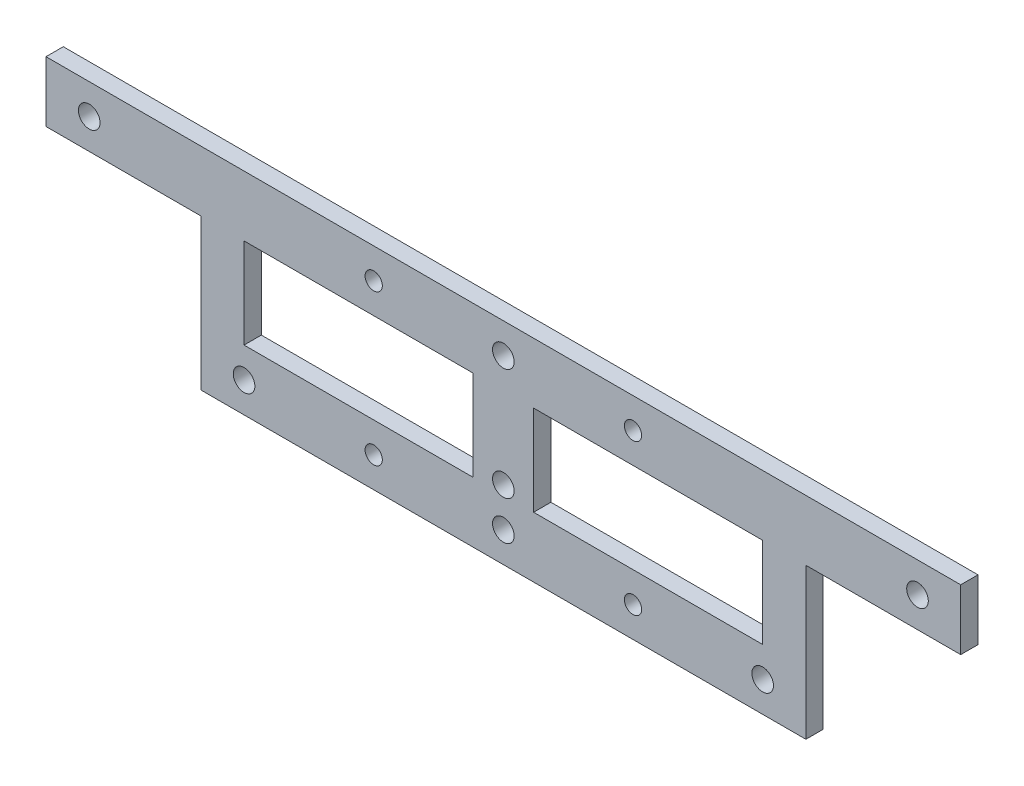
from build123d import *

# Parameters (mm, degrees)
SKETCH1_W           = 53
SKETCH1_H           = 20.877946607
SKETCH1_R           = 2.5
SKETCH1_R_2         = 2
BOSS_EXTRUDE1_DEPTH = 4


with BuildPart() as part:
    # Sketch1 → Boss-Extrude1 (new body)
    with BuildSketch(Plane.XY):
        Polygon((-70, 27.877946607), (-70, -7), (70, -7), (70, 27.877946607), (105.826370741, 27.877946607), (105.826370741, 41.877946607), (-105.826370741, 41.877946607), (-105.826370741, 27.877946607), align=None)
        with Locations((33.5, 17.438973303)):
            Rectangle(SKETCH1_W, SKETCH1_H, mode=Mode.SUBTRACT)
        with Locations((0, 9)):
            Circle(SKETCH1_R, mode=Mode.SUBTRACT)
        with Locations((-33.5, 17.438973303)):
            Rectangle(SKETCH1_W, SKETCH1_H, mode=Mode.SUBTRACT)
        with Locations((60, 0)):
            Circle(SKETCH1_R, mode=Mode.SUBTRACT)
        with Locations((-60, 0)):
            Circle(SKETCH1_R, mode=Mode.SUBTRACT)
        with Locations((-30, 0)):
            Circle(SKETCH1_R_2, mode=Mode.SUBTRACT)
        Circle(SKETCH1_R, mode=Mode.SUBTRACT)
        with Locations((30, 0)):
            Circle(SKETCH1_R_2, mode=Mode.SUBTRACT)
        with Locations((-30, 34.877946607)):
            Circle(SKETCH1_R_2, mode=Mode.SUBTRACT)
        with Locations((-95.826370741, 34.877946607)):
            Circle(SKETCH1_R, mode=Mode.SUBTRACT)
        with Locations((0, 34.877946607)):
            Circle(SKETCH1_R, mode=Mode.SUBTRACT)
        with Locations((95.826370741, 34.877946607)):
            Circle(SKETCH1_R, mode=Mode.SUBTRACT)
        with Locations((30, 34.877946607)):
            Circle(SKETCH1_R_2, mode=Mode.SUBTRACT)
    extrude(amount=BOSS_EXTRUDE1_DEPTH)


solid = part.part
